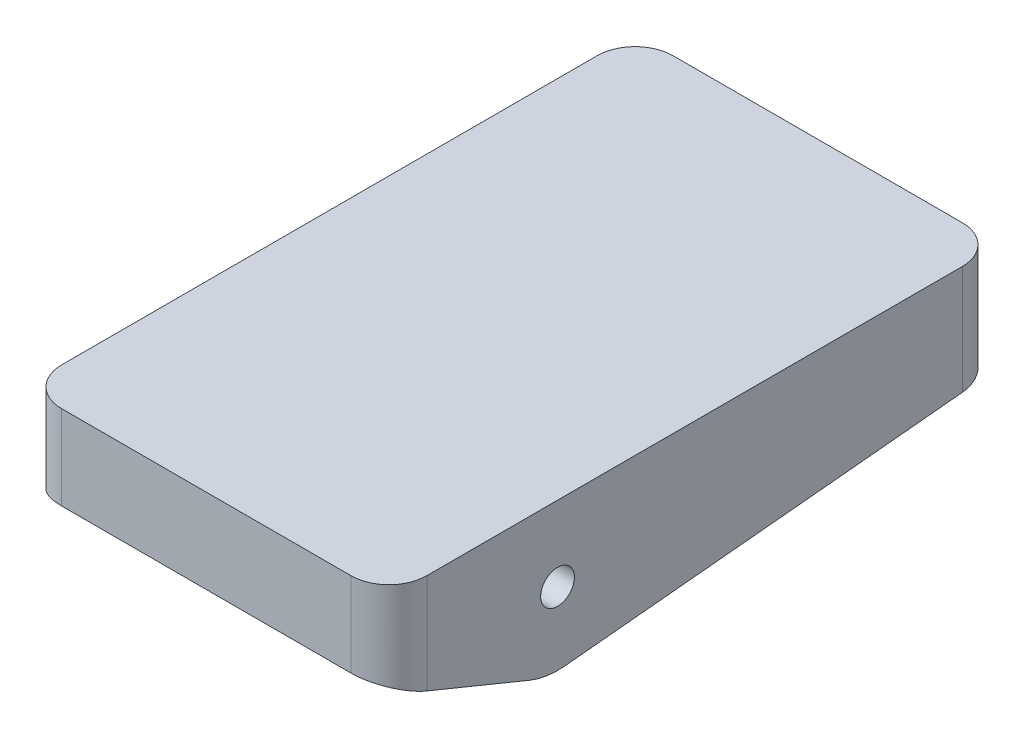
from build123d import *

# Parameters (mm, degrees)
SKETCH4_W           = 86.6
SKETCH4_H           = 145
SKETCH4_W_2         = 78.6
SKETCH4_H_2         = 137
BOSS_EXTRUDE2_DEPTH = 30
SKETCH5_W           = 86.6
SKETCH5_H           = 145
BOSS_EXTRUDE3_DEPTH = 5
SKETCH6_R           = 4
CUT_EXTRUDE2_DEPTH  = 56.5
BOSS_EXTRUDE1_START = 5
SKETCH1_R           = 4
BOSS_EXTRUDE1_DEPTH = 5
SKETCH7_W           = 68.6
SKETCH7_H           = 15.75
SKETCH7_H_2         = 22.125
CUT_EXTRUDE3_DEPTH  = 2.5
FILLET1_R           = 9
SKETCH12_W          = 57.6
SKETCH12_H          = 3
BOSS_EXTRUDE6_DEPTH = 8.5
SKETCH13_W          = 5
SKETCH13_H          = 2.5
CUT_EXTRUDE4_DEPTH  = 5
FILLET6_R           = 1
FILLET2_R           = 2
FILLET3_R           = 5
SKETCH10_R          = 3
BOSS_EXTRUDE4_DEPTH = 2.5
FILLET4_R           = 0.5
SKETCH11_W          = 48.6
SKETCH11_H          = 5
BOSS_EXTRUDE5_DEPTH = 0.75
FILLET5_R           = 1


with BuildPart() as part:
    # Sketch4 → Boss-Extrude2 (new body)
    with BuildSketch(Plane(origin=(0, 12.8, 0), x_dir=(1, 0, 0), z_dir=(0, 1, 0))):
        with Locations((0, 32.5)):
            Rectangle(SKETCH4_W, SKETCH4_H)
        with Locations((0, 32.5)):
            Rectangle(SKETCH4_W_2, SKETCH4_H_2, mode=Mode.SUBTRACT)
    extrude(amount=-BOSS_EXTRUDE2_DEPTH)

    # Sketch5 → Boss-Extrude3 (add)
    with BuildSketch(Plane(origin=(0, 12.8, 0), x_dir=(1, 0, 0), z_dir=(0, 1, 0))):
        with Locations((0, 32.5)):
            Rectangle(SKETCH5_W, SKETCH5_H)
    extrude(amount=BOSS_EXTRUDE3_DEPTH)

    # Sketch6 → Cut-Extrude2 (cut, symmetric)
    with BuildSketch(Plane(origin=(0, 0, 0), x_dir=(0, 0, -1), z_dir=(1, 0, 0))):
        Circle(SKETCH6_R)
        with BuildLine():
            Line((-40, -2.2), (-6.520615654, -15.916079024))
            ThreePointArc((-6.520615654, -15.916079024), (-2.511916424, -17.015589202), (1.643491767, -17.121300617))
            Line((1.643491767, -17.121300617), (105, -7.2))
            Line((105, -7.2), (105, -30))
            Line((105, -30), (-40, -30))
            Line((-40, -30), (-40, -2.2))
        make_face()
    extrude(amount=CUT_EXTRUDE2_DEPTH, both=True, mode=Mode.SUBTRACT)

    # Sketch1 → Boss-Extrude1 (add)
    with BuildSketch(Plane(origin=(-39.3, 0, 0), x_dir=(0, 0, -1), z_dir=(1, 0, 0)).offset(BOSS_EXTRUDE1_START)):
        with BuildLine():
            Line((-12.295827489, 0.320353501), (-27.31993911, 12.8))
            Line((-27.31993911, 12.8), (97.713486421, 12.8))
            Line((97.713486421, 12.8), (11.842309408, -3.324110088))
            ThreePointArc((11.842309408, -3.324110088), (-1.836286572, -12.162156537), (-12.295827489, 0.320353501))
        make_face()
        Circle(SKETCH1_R, mode=Mode.SUBTRACT)
    boss_extrude1 = extrude(amount=-BOSS_EXTRUDE1_DEPTH)

    # Mirror1: Boss-Extrude1 across plane
    add(boss_extrude1.mirror(Plane(origin=(0, 0, 0), x_dir=(0, 0, 1), z_dir=(1, 0, 0))))

    # Sketch7 → Cut-Extrude3 (cut)
    with BuildSketch(Plane.XZ.offset(-12.8)):
        with Locations((0, 28.125)):
            Rectangle(SKETCH7_W, SKETCH7_H)
        with Locations((0, -89.9375)):
            Rectangle(SKETCH7_W, SKETCH7_H_2)
        with Locations((0, 9.375)):
            Rectangle(SKETCH7_W, SKETCH7_H)
        with Locations((0, -12.5625)):
            Rectangle(SKETCH7_W, SKETCH7_H_2)
        with Locations((0, -39.6875)):
            Rectangle(SKETCH7_W, SKETCH7_H_2)
        with Locations((0, -64.8125)):
            Rectangle(SKETCH7_W, SKETCH7_H_2)
    extrude(amount=-CUT_EXTRUDE3_DEPTH, mode=Mode.SUBTRACT)

    # Fillet1
    fillet1_edges = [part.edges().sort_by_distance(p)[0] for p in [
        (43.3, 7.8, 40),
        (-43.3, 7.8, 40),
        (43.3, 5.3, -105),
        (-43.3, 5.3, -105),
    ]]
    fillet(fillet1_edges, radius=FILLET1_R)

    # Sketch12 → Boss-Extrude6 (add)
    with BuildSketch(Plane.XZ.offset(-12.8)):
        Rectangle(SKETCH12_W, SKETCH12_H)
    extrude(amount=BOSS_EXTRUDE6_DEPTH)

    # Sketch13 → Cut-Extrude4 (cut)
    with BuildSketch(Plane(origin=(0, 0, -1.5), x_dir=(-1, 0, 0), z_dir=(0, 0, -1))):
        with Locations((-26.3, 5.55)):
            Rectangle(SKETCH13_W, SKETCH13_H)
        with Locations((26.3, 5.55)):
            Rectangle(SKETCH13_W, SKETCH13_H)
    extrude(amount=-CUT_EXTRUDE4_DEPTH, mode=Mode.SUBTRACT)

    # Fillet6
    fillet6_edges = [part.edges().sort_by_distance(p)[0] for p in [
        (-23.8, 4.3, 0),
        (23.8, 4.3, 0),
    ]]
    fillet(fillet6_edges, radius=FILLET6_R)

    # Fillet2
    fillet2_edges = [part.edges().sort_by_distance(p)[0] for p in [
        (-34.3, 14.05, 20.25),
        (-34.3, 14.05, 36),
        (34.3, 14.05, 36),
        (34.3, 14.05, 20.25),
        (-34.3, 14.05, -75.875),
        (-34.3, 14.05, -53.75),
        (34.3, 14.05, -53.75),
        (34.3, 14.05, -75.875),
        (34.3, 14.05, -78.875),
        (34.3, 14.05, -101),
        (-34.3, 14.05, -101),
        (-34.3, 14.05, -78.875),
        (-34.3, 14.05, 1.5),
        (-34.3, 14.05, 17.25),
        (34.3, 14.05, 17.25),
        (34.3, 14.05, 1.5),
        (-34.3, 14.05, -23.625),
        (-34.3, 14.05, -1.5),
        (34.3, 14.05, -1.5),
        (34.3, 14.05, -23.625),
        (-34.3, 14.05, -50.75),
        (-34.3, 14.05, -28.625),
        (34.3, 14.05, -28.625),
    ]]
    fillet(fillet2_edges, radius=FILLET2_R)

    # Fillet3
    fillet3_edges = [part.edges().sort_by_distance(p)[0] for p in [
        (39.3, 4.480625373, 36),
        (-39.3, 4.480625373, 36),
        (39.3, 2.608017883, -101),
        (-39.3, 2.608017883, -101),
    ]]
    fillet(fillet3_edges, radius=FILLET3_R)

    # Sketch10 → Boss-Extrude4 (add)
    with BuildSketch(Plane.XZ.offset(-15.3)):
        with Locations(Location((-22.3, 24, 0), (0, 0, 270))):
            Circle(SKETCH10_R)
    extrude(amount=BOSS_EXTRUDE4_DEPTH)

    # Fillet4
    fillet4_edges = [part.edges().sort_by_distance(p)[0] for p in [
        (-22.3, 12.8, 27),
    ]]
    fillet(fillet4_edges, radius=FILLET4_R)

    # Sketch11 → Boss-Extrude5 (add, symmetric)
    with BuildSketch(Plane.XZ.offset(-12.8)):
        with BuildLine():
            Line((-29.3, -23.625), (-32.3, -23.625))
            ThreePointArc((-32.3, -23.625), (-33.714213562, -23.039213562), (-34.3, -21.625))
            Line((-34.3, -21.625), (-34.3, -30.625))
            ThreePointArc((-34.3, -30.625), (-33.714213562, -29.210786438), (-32.3, -28.625))
            Line((-32.3, -28.625), (-29.3, -28.625))
            Line((-29.3, -28.625), (-29.3, -23.625))
        make_face()
        with BuildLine():
            Line((32.3, -23.625), (29.3, -23.625))
            Line((29.3, -23.625), (29.3, -28.625))
            Line((29.3, -28.625), (32.3, -28.625))
            ThreePointArc((32.3, -28.625), (33.714213562, -29.210786438), (34.3, -30.625))
            Line((34.3, -30.625), (34.3, -21.625))
            ThreePointArc((34.3, -21.625), (33.714213562, -23.039213562), (32.3, -23.625))
        make_face()
        with Locations((0, -26.125)):
            Rectangle(SKETCH11_W, SKETCH11_H)
    extrude(amount=BOSS_EXTRUDE5_DEPTH, both=True)

    # Fillet5
    fillet5_edges = [part.edges().sort_by_distance(p)[0] for p in [
        (26.8, 12.8, -28.625),
        (-26.8, 12.8, -23.625),
        (26.8, 12.8, -23.625),
        (-26.8, 12.8, -28.625),
    ]]
    fillet(fillet5_edges, radius=FILLET5_R)


solid = part.part
